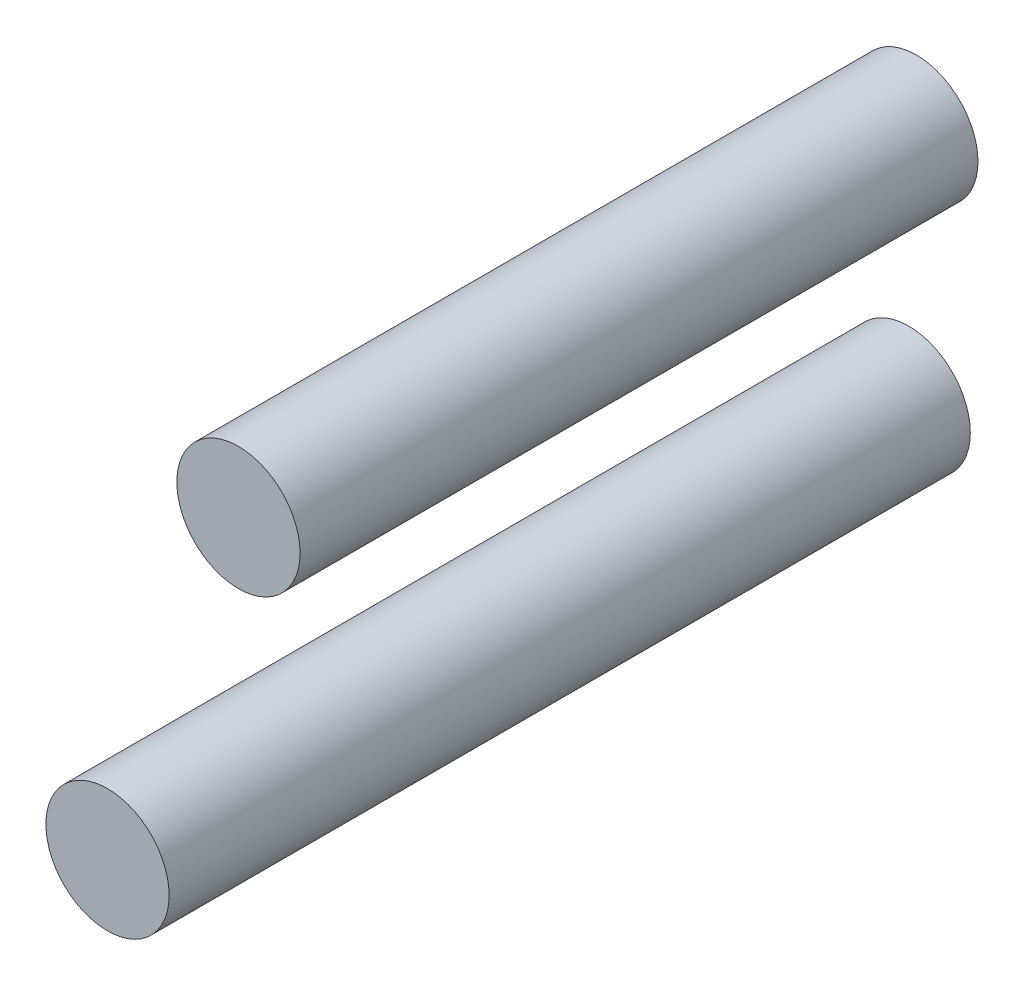
from build123d import *

# Parameters (mm, degrees)
SZKIC1_R                    = 10
DODANIE_WYCI_GNI_CIE1_DEPTH = 65
SZKIC3_R                    = 10
DODANIE_WYCI_GNI_CIE3_DEPTH = 55


with BuildPart() as part:
    # Szkic1 → Dodanie-wyciągnięcie1 (new, symmetric)
    with BuildSketch(Plane.XY):
        with Locations((-25, 0)):
            Circle(SZKIC1_R)
    extrude(amount=DODANIE_WYCI_GNI_CIE1_DEPTH, both=True)


with BuildPart() as body_2:
    # Szkic3 → Dodanie-wyciągnięcie3 (new, symmetric)
    with BuildSketch(Plane.XY):
        with Locations((-13.752447283, 48.718503239)):
            Circle(SZKIC3_R)
    extrude(amount=DODANIE_WYCI_GNI_CIE3_DEPTH, both=True)


solid = Compound([part.part, body_2.part])
